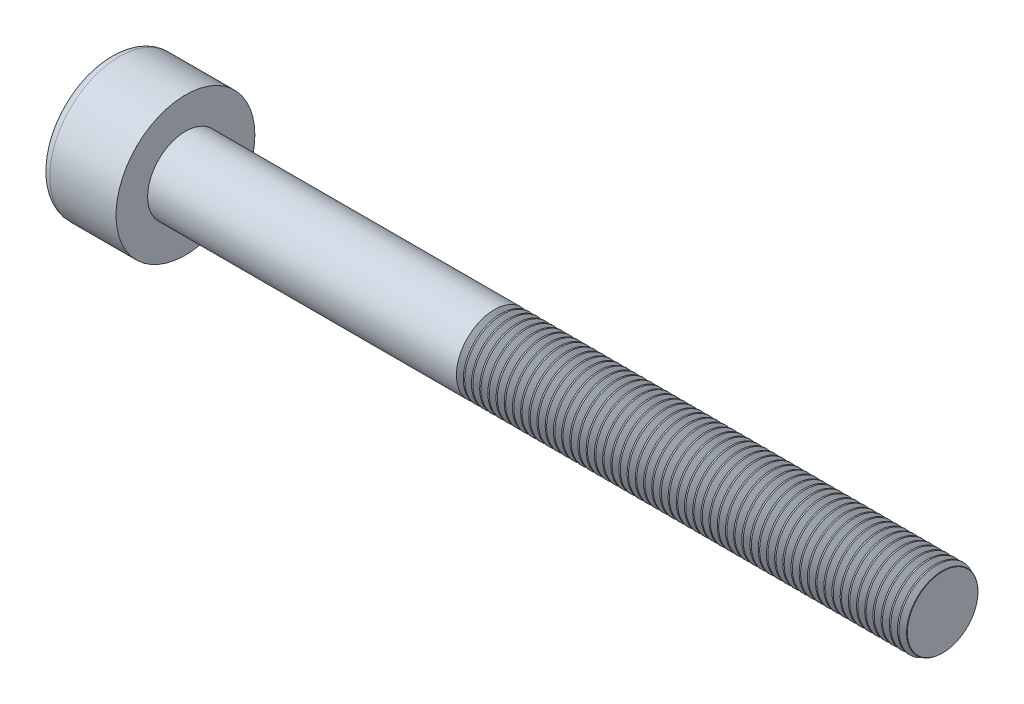
from build123d import *

# Parameters (mm, degrees)
SKETCH1_R           = 2.75
BASEHEAD_DEPTH      = 3
SKETCH2_R           = 1.5
BASEBODY_DEPTH      = 30
HEXAGONSOCKET_DEPTH = 1.3
TOPFILLET_R         = 0.375
CHAMFER1_SIZE       = 0.1
LPATTERN10_COUNT    = 55
LPATTERN10_PITCH    = 0.3246


with BuildPart() as part:
    # Sketch1 → BaseHead (new body)
    with BuildSketch(Plane(origin=(0, 0, 0), x_dir=(0, 0, -1), z_dir=(1, 0, 0))):
        Circle(SKETCH1_R)
    extrude(amount=BASEHEAD_DEPTH)

    # Sketch2 → BaseBody (add)
    with BuildSketch(Plane(origin=(3, 0, 0), x_dir=(0, 0, -1), z_dir=(1, 0, 0))):
        Circle(SKETCH2_R)
    extrude(amount=BASEBODY_DEPTH)

    # Sketch3 → HexagonSocket (cut)
    with BuildSketch(Plane(origin=(0, 0, 0), x_dir=(0, 0, -1), z_dir=(1, 0, 0))):
        Polygon((1.443375673, 0), (0.721687836, 1.25), (-0.721687836, 1.25), (-1.443375673, 0), (-0.721687836, -1.25), (0.721687836, -1.25), align=None)
    extrude(amount=HEXAGONSOCKET_DEPTH, mode=Mode.SUBTRACT)

    # Sketch4 → Cut-Revolve1 (revolve, cut)
    with BuildSketch(Plane(origin=(-4.19613823, 0.75, 0), x_dir=(-1, 0, 0), z_dir=(0, 0, 1)), mode=Mode.PRIVATE) as cut_revolve1_sk:
        Polygon((-5.49613823, 2), (-6.217826066, 0.75), (-5.49613823, 0.75), align=None)
    revolve(cut_revolve1_sk.sketch.rotate(Axis((0.838992387, 0, 0), (-1, 0, 0)), 90), axis=Axis((0.838992387, 0, 0), (-1, 0, 0)), mode=Mode.SUBTRACT)

    # TopFillet
    topfillet_edges = [part.edges().sort_by_distance(p)[0] for p in [
        (0, 0, 2.75),
    ]]
    fillet(topfillet_edges, radius=TOPFILLET_R)

    # Chamfer1
    chamfer1_edges = [part.edges().sort_by_distance(p)[0] for p in [
        (33, 0, 1.5),
    ]]
    chamfer(chamfer1_edges, length=CHAMFER1_SIZE)

    # Sketch5 → Cut-Revolve10 (revolve, cut)
    with BuildSketch(Plane.XY, mode=Mode.PRIVATE) as cut_revolve10_sk:
        Polygon((32.9, 1.265740128), (33.03525, 1.5), (33.03525, 1.7705), (32.76475, 1.7705), (32.76475, 1.5), align=None)
    cut_revolve10 = revolve(cut_revolve10_sk.sketch.rotate(Axis((0, 0, 0), (1, 0, 0)), 90), axis=Axis((0, 0, 0), (1, 0, 0)), mode=Mode.SUBTRACT)

    # LPattern10: Cut-Revolve10 ×55
    with Locations(*[(-i * LPATTERN10_PITCH, 0, 0) for i in range(1, LPATTERN10_COUNT)]):
        add(cut_revolve10, mode=Mode.SUBTRACT)


solid = part.part
